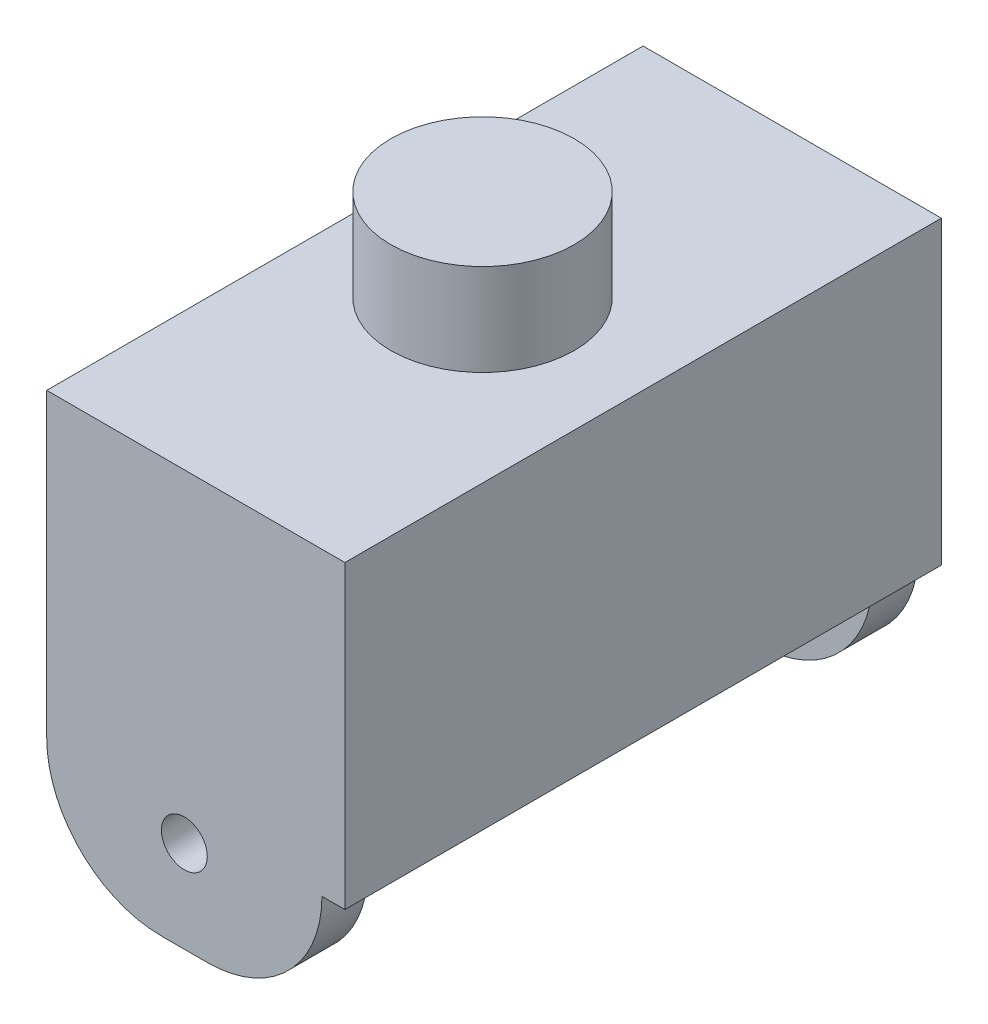
from build123d import *

# Parameters (mm, degrees)
SKETCH1_R           = 5
BOSS_EXTRUDE1_DEPTH = 10
BOSS_EXTRUDE2_DEPTH = 55
SKETCH3_R           = 20
BOSS_EXTRUDE3_DEPTH = 20
SKETCH4_W           = 130
SKETCH4_H           = 65.511911844
BOSS_EXTRUDE4_DEPTH = 5


with BuildPart() as part:
    # Sketch1 → Boss-Extrude1 (new body)
    with BuildSketch(Plane.XY):
        with BuildLine():
            Line((-30, 40.511911844), (30, 40.511911844))
            Line((30, 40.511911844), (30, -25))
            ThreePointArc((30, -25), (22.67766953, -42.67766953), (5, -50))
            Line((5, -50), (-5, -50))
            ThreePointArc((-5, -50), (-22.67766953, -42.67766953), (-30, -25))
            Line((-30, -25), (-30, 40.511911844))
        make_face()
        with Locations((0, -30)):
            Circle(SKETCH1_R, mode=Mode.SUBTRACT)
    boss_extrude1 = extrude(amount=BOSS_EXTRUDE1_DEPTH)

    # Sketch2 → Boss-Extrude2 (add)
    with BuildSketch(Plane(origin=(0, 0, 0), x_dir=(-1, 0, 0), z_dir=(0, 0, -1))):
        Polygon((-30, 40.511911844), (-30, -25), (-25, -25), (-25, 30.511911844), (30, 30.511911844), (30, 40.511911844), align=None)
    boss_extrude2 = extrude(amount=BOSS_EXTRUDE2_DEPTH)

    # Mirror1: Boss-Extrude1, Boss-Extrude2 across plane
    add(boss_extrude1.mirror(Plane(origin=(0, 0, -55), x_dir=(1, 0, 0), z_dir=(0, 0, -1))))
    add(boss_extrude2.mirror(Plane(origin=(0, 0, -55), x_dir=(1, 0, 0), z_dir=(0, 0, -1))))

    # Sketch3 → Boss-Extrude3 (add)
    with BuildSketch(Plane(origin=(0, 40.511911844, 0), x_dir=(1, 0, 0), z_dir=(0, 1, 0))):
        with Locations(Location((0, 55, 0), (0, 0, 270))):
            Circle(SKETCH3_R)
    extrude(amount=BOSS_EXTRUDE3_DEPTH)

    # Sketch4 → Boss-Extrude4 (add)
    with BuildSketch(Plane(origin=(30, 0, 0), x_dir=(0, 0, -1), z_dir=(1, 0, 0))):
        with Locations((55, 7.755955922)):
            Rectangle(SKETCH4_W, SKETCH4_H)
    extrude(amount=BOSS_EXTRUDE4_DEPTH)


solid = part.part
